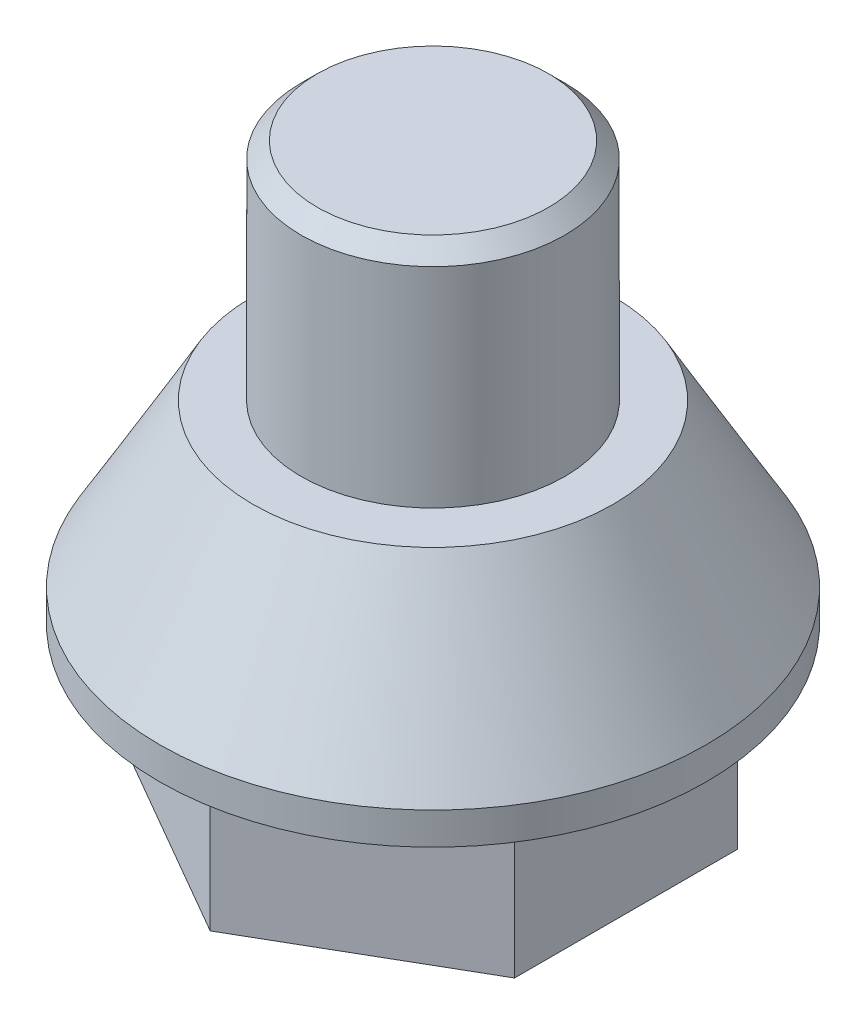
from build123d import *

# Parameters (mm, degrees)
BOSS_EXTRUDE1_DEPTH = 4.8
SKETCH2_R           = 8.5
BOSS_EXTRUDE2_DEPTH = 1
CHAMFER1_SIZE       = 0.5


with BuildPart() as part:
    # Sketch1 → Boss-Extrude1 (new body)
    with BuildSketch(Plane(origin=(0, 0, 0), x_dir=(1, 0, 0), z_dir=(0, 1, 0))):
        Polygon((0, 6.92820323), (6, 3.464101615), (6, -3.464101615), (0, -6.92820323), (-6, -3.464101615), (-6, 3.464101615), align=None)
    extrude(amount=BOSS_EXTRUDE1_DEPTH)

    # Sketch2 → Boss-Extrude2 (add)
    with BuildSketch(Plane(origin=(0, 4.8, 0), x_dir=(1, 0, 0), z_dir=(0, 1, 0))):
        with Locations(Location((0, 0, 0), (0, 0, 270))):
            Circle(SKETCH2_R)
    extrude(amount=BOSS_EXTRUDE2_DEPTH)

    # Sketch3 → Revolve1 (revolve)
    with BuildSketch(Plane.XY):
        Polygon((0, 5.8), (8.5, 5.8), (5.6, 10.822947342), (4.1, 10.822947342), (4.1, 17.822947342), (0, 17.822947342), align=None)
    revolve(axis=Axis((0, 5.8, 0), (0, 1, 0)))

    # Chamfer1
    chamfer1_edges = [part.edges().sort_by_distance(p)[0] for p in [
        (-4.1, 17.822947342, 0),
    ]]
    chamfer(chamfer1_edges, length=CHAMFER1_SIZE)


solid = part.part
